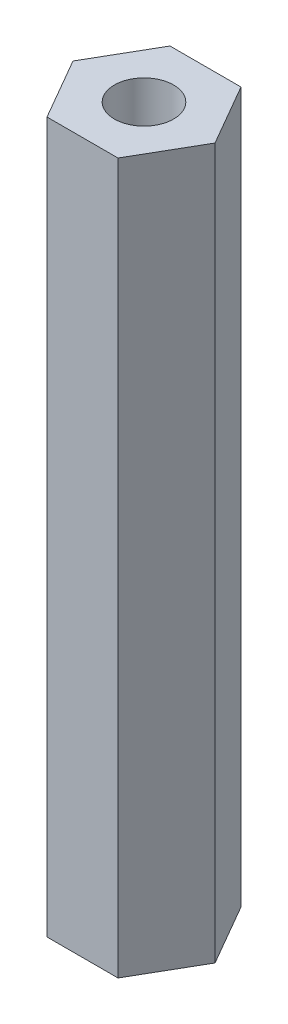
from build123d import *

# Parameters (mm, degrees)
EXTRUDE_1_DEPTH    = 30
HOLE_WIZARD_M3_1_D = 2.5


with BuildPart() as part:
    # 草图1 → 凸台-拉伸1 (new body)
    with BuildSketch(Plane(origin=(0, 0, 0), x_dir=(1, 0, 0), z_dir=(0, 1, 0))):
        Polygon((1.5, 2.598076211), (-1.5, 2.598076211), (-3, 0), (-1.5, -2.598076211), (1.5, -2.598076211), (3, 0), align=None)
    extrude(amount=EXTRUDE_1_DEPTH)

    # M3 螺纹孔1 (through all)
    with Locations(Plane(origin=(0, 30, 0), x_dir=(1, 0, 0), z_dir=(0, 1, 0))):
        with Locations((0, 0)):
            Hole(HOLE_WIZARD_M3_1_D / 2)


solid = part.part
